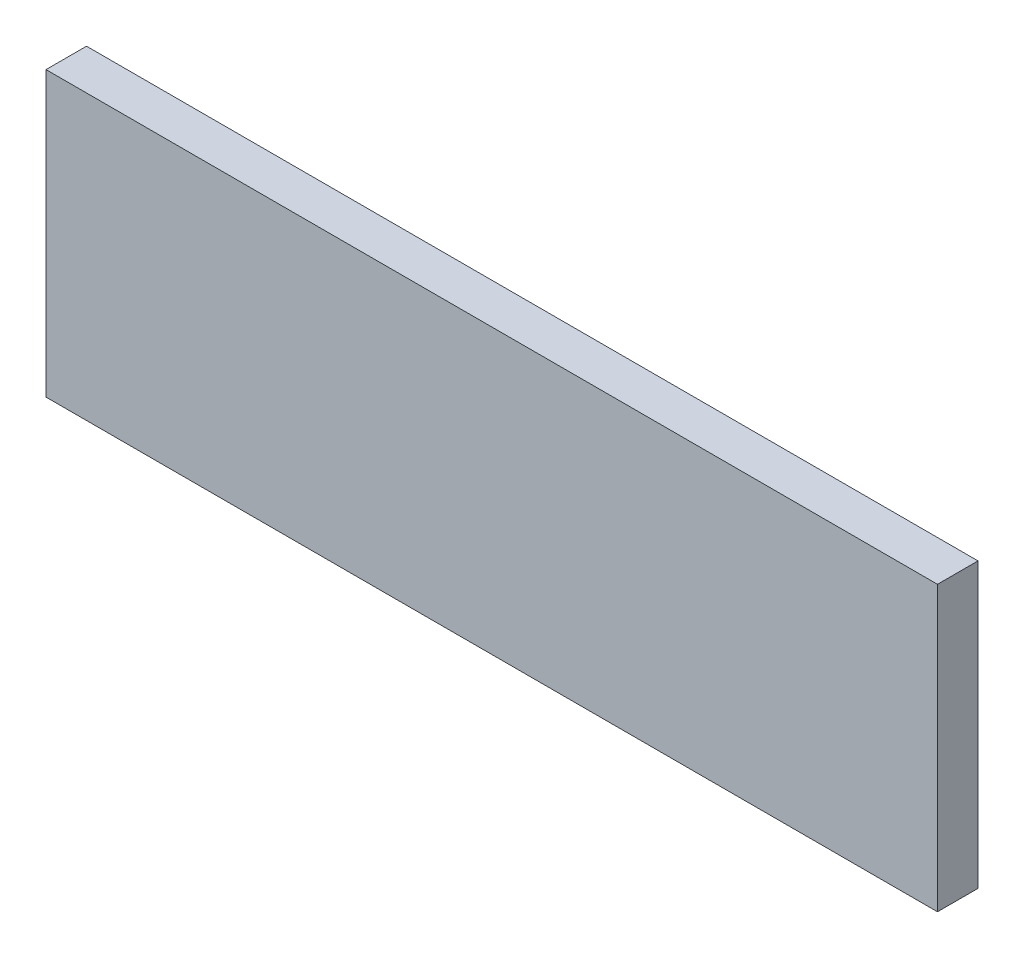
from build123d import *

# Parameters (mm, degrees)
ESBO_O1_W                = 330
ESBO_O1_H                = 105
RESSALTO_EXTRUS_O1_DEPTH = 15


with BuildPart() as part:
    # Esboço1 → Ressalto-extrusão1 (new body)
    with BuildSketch(Plane.XY):
        Rectangle(ESBO_O1_W, ESBO_O1_H)
    extrude(amount=RESSALTO_EXTRUS_O1_DEPTH)


solid = part.part
